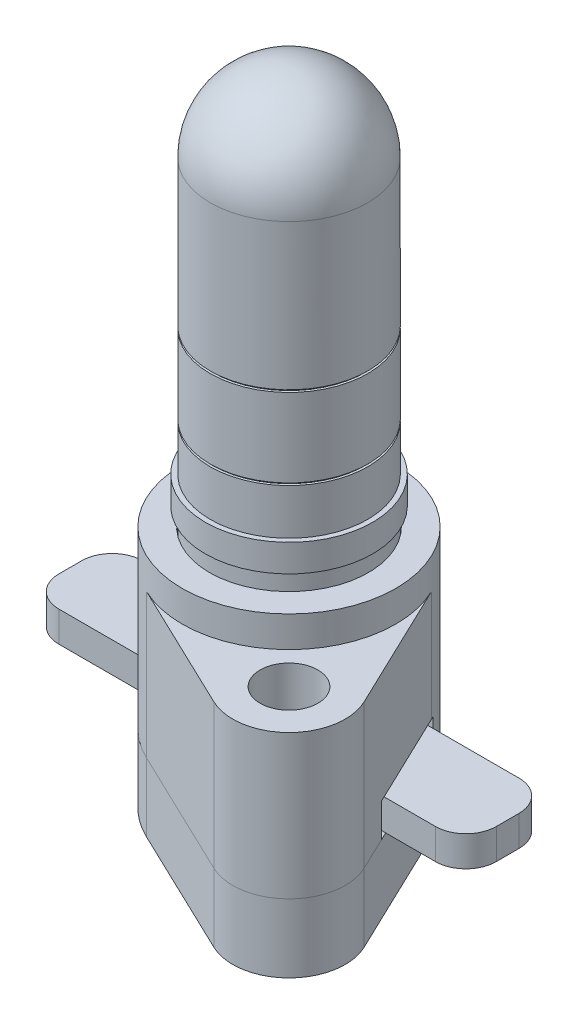
from build123d import *

# Parameters (mm, degrees)
SKETCH1_R               = 15
SKETCH1_R_2             = 1.75
BOSS_EXTRUDE1_DEPTH     = 4.5
SKETCH2_R               = 5.225
SKETCH2_R_2             = 1.9
BOSS_EXTRUDE2_DEPTH     = 11.5
SKETCH3_W               = 31.199300702
SKETCH3_H               = 26.807769262
SKETCH3_R               = 7.025
CUT_EXTRUDE1_DEPTH      = 2.03
CUT_EXTRUDE2_DEPTH      = 25.129857024
CUT_EXTRUDE2_DEPTH_BACK = 25.129857024
SKETCH4_W               = 6.5
SKETCH4_H               = 2.2
SKETCH5_R               = 15
SKETCH5_R_2             = 1.4
CUT_EXTRUDE4_DEPTH      = 25.129857024
BOSS_EXTRUDE3_DEPTH     = 2


with BuildPart() as part:
    # Sketch1 → Boss-Extrude1 (new body)
    with BuildSketch(Plane(origin=(0, 0, 0), x_dir=(1, 0, 0), z_dir=(0, 1, 0))):
        Circle(SKETCH1_R)
        Circle(SKETCH1_R_2, mode=Mode.SUBTRACT)
    extrude(amount=-BOSS_EXTRUDE1_DEPTH)

    # Sketch5 → Cut-Extrude4 (cut, through all)
    # profile 1 of 3: a face of its own
    with BuildSketch(Plane(origin=(0, 0, 0), x_dir=(1, 0, 0), z_dir=(0, 1, 0))):
        Circle(SKETCH5_R)
        with BuildLine():
            Line((-6.336463676, -3.033125959), (-10.408422346, 5.473549513))
            ThreePointArc((-10.408422346, 5.473549513), (-9.687362902, 9.687362902), (-5.473549513, 10.408422346))
            Line((-5.473549513, 10.408422346), (3.033125959, 6.336463676))
            ThreePointArc((3.033125959, 6.336463676), (4.967425138, 4.967425138), (6.336463676, 3.033125959))
            Line((6.336463676, 3.033125959), (10.408422346, -5.473549513))
            ThreePointArc((10.408422346, -5.473549513), (9.687362902, -9.687362902), (5.473549513, -10.408422346))
            Line((5.473549513, -10.408422346), (-3.033125959, -6.336463676))
            ThreePointArc((-3.033125959, -6.336463676), (-4.967425138, -4.967425138), (-6.336463676, -3.033125959))
        make_face(mode=Mode.SUBTRACT)
    # profile 2 of 3: a face of its own
    with BuildSketch(Plane(origin=(0, 0, 0), x_dir=(1, 0, 0), z_dir=(0, 1, 0))):
        with Locations((-7.071067812, 7.071067812)):
            Circle(SKETCH5_R_2)
    # profile 3 of 3: a face of its own
    with BuildSketch(Plane(origin=(0, 0, 0), x_dir=(1, 0, 0), z_dir=(0, 1, 0))):
        with Locations((7.071067812, -7.071067812)):
            Circle(SKETCH5_R_2)
    extrude(amount=-CUT_EXTRUDE4_DEPTH, mode=Mode.SUBTRACT)


with BuildPart() as body_2:
    # Sketch2 → Boss-Extrude2 (new body)
    with BuildSketch(Plane(origin=(0, 0, 0), x_dir=(1, 0, 0), z_dir=(0, 1, 0))):
        with BuildLine():
            Line((-10.408422346, 5.473549513), (-6.336463676, -3.033125959))
            ThreePointArc((-6.336463676, -3.033125959), (-4.967425138, -4.967425138), (-3.033125959, -6.336463676))
            Line((-3.033125959, -6.336463676), (5.473549513, -10.408422346))
            ThreePointArc((5.473549513, -10.408422346), (9.687362902, -9.687362902), (10.408422346, -5.473549513))
            Line((10.408422346, -5.473549513), (6.336463676, 3.033125959))
            ThreePointArc((6.336463676, 3.033125959), (4.967425138, 4.967425138), (3.033125959, 6.336463676))
            Line((3.033125959, 6.336463676), (-5.473549513, 10.408422346))
            ThreePointArc((-5.473549513, 10.408422346), (-9.687362902, 9.687362902), (-10.408422346, 5.473549513))
        make_face()
        Circle(SKETCH2_R, mode=Mode.SUBTRACT)
        with Locations((-7.071067812, 7.071067812)):
            Circle(SKETCH2_R_2, mode=Mode.SUBTRACT)
        with Locations((7.071067812, -7.071067812)):
            Circle(SKETCH2_R_2, mode=Mode.SUBTRACT)
    extrude(amount=BOSS_EXTRUDE2_DEPTH)

    # Sketch3 → Cut-Extrude1 (cut)
    with BuildSketch(Plane(origin=(0, 11.5, 0), x_dir=(1, 0, 0), z_dir=(0, 1, 0))):
        Rectangle(SKETCH3_W, SKETCH3_H)
        Circle(SKETCH3_R, mode=Mode.SUBTRACT)
    extrude(amount=-CUT_EXTRUDE1_DEPTH, mode=Mode.SUBTRACT)

    # Sketch4 → Cut-Extrude2 (cut, two sides: drawn at the far end of the back side and taken through both)
    with BuildSketch(Plane(origin=(0, 0, 0), x_dir=(0, 0, -1), z_dir=(1, 0, 0)).offset(-CUT_EXTRUDE2_DEPTH_BACK)):
        with Locations((0, 1.1)):
            Rectangle(SKETCH4_W, SKETCH4_H)
    extrude(amount=CUT_EXTRUDE2_DEPTH + CUT_EXTRUDE2_DEPTH_BACK, mode=Mode.SUBTRACT)


with BuildPart() as body_3:
    # Sketch8 → Revolve1 (revolve)
    with BuildSketch(Plane(origin=(0, 0, 0), x_dir=(0, 0, -1), z_dir=(1, 0, 0))):
        with BuildLine():
            Line((0, 32.525), (0, 37.7))
            ThreePointArc((0, 37.7), (-3.659277593, 36.184277593), (-5.175, 32.525))
            Line((-5.175, 32.525), (-5.175, 22.95))
            Line((-5.175, 22.95), (-5.025, 22.8))
            Line((-5.025, 22.8), (-5.175, 22.8))
            Line((-5.175, 22.8), (-5.175, 17.65))
            Line((-5.175, 17.65), (-5.025, 17.5))
            Line((-5.025, 17.5), (-5.175, 17.5))
            Line((-5.175, 17.5), (-5.175, 14.5))
            Line((-5.175, 14.5), (-5.5, 14.5))
            Line((-5.5, 14.5), (-5.5, 12.7))
            Line((-5.5, 12.7), (-5.175, 12.7))
            Line((-5.175, 12.7), (-5.175, 0))
            Line((-5.175, 0), (0, 0))
            Line((0, 0), (0, 32.525))
        make_face()
    revolve(axis=Axis((0, 0, 0), (0, -1, 0)))

    # Sketch9 → Boss-Extrude3 (add)
    with BuildSketch(Plane(origin=(0, 0, 0), x_dir=(1, 0, 0), z_dir=(0, 1, 0))):
        with BuildLine():
            Line((-12.375, -2.75), (-2.375, -2.75))
            Line((-2.375, -2.75), (-2.375, 2.75))
            Line((-2.375, 2.75), (-12.375, 2.75))
            ThreePointArc((-12.375, 2.75), (-13.789213562, 2.164213562), (-14.375, 0.75))
            Line((-14.375, 0.75), (-14.375, -0.75))
            ThreePointArc((-14.375, -0.75), (-13.789213562, -2.164213562), (-12.375, -2.75))
        make_face()
        with BuildLine():
            Line((2.375, -2.75), (2.375, 2.75))
            Line((2.375, 2.75), (12.375, 2.75))
            ThreePointArc((12.375, 2.75), (13.789213562, 2.164213562), (14.375, 0.75))
            Line((14.375, 0.75), (14.375, -0.75))
            ThreePointArc((14.375, -0.75), (13.789213562, -2.164213562), (12.375, -2.75))
            Line((12.375, -2.75), (2.375, -2.75))
        make_face()
    extrude(amount=BOSS_EXTRUDE3_DEPTH)


solid = Compound([part.part, body_2.part, body_3.part])
